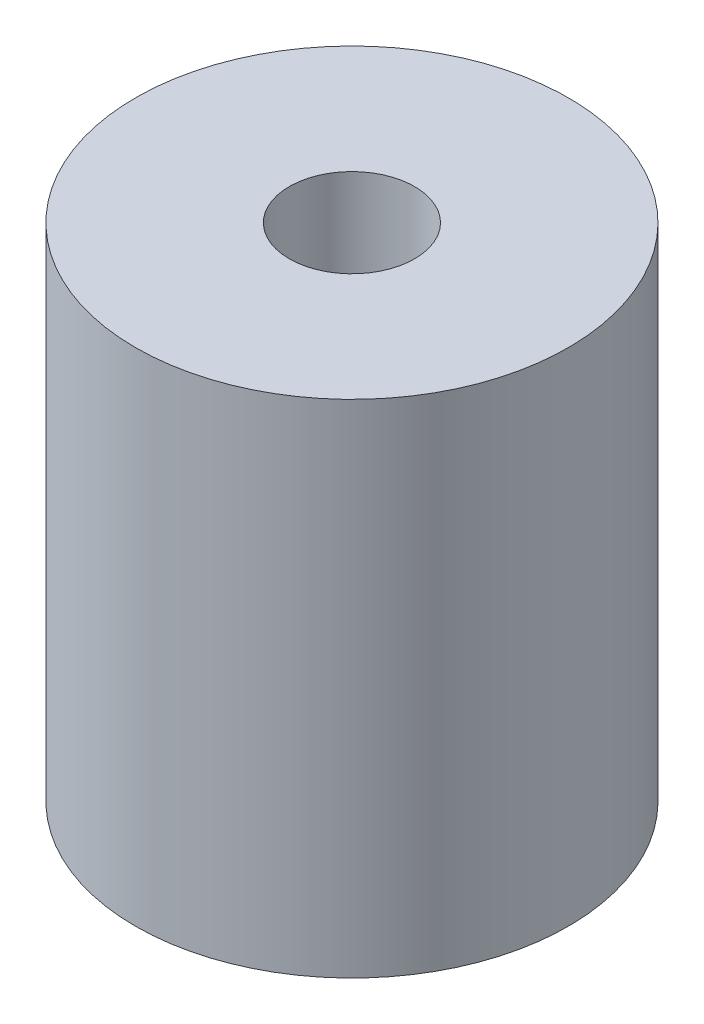
from build123d import *

# Parameters (mm, degrees)
ESBO_O1_R                = 9.5
ESBO_O1_R_2              = 3.25
ESBO_O1_R_3              = 2.75
RESSALTO_EXTRUS_O1_DEPTH = 11


with BuildPart() as part:
    # Esboço1 → Ressalto-extrusão1 (new, symmetric)
    # profile 1 of 2: a face of its own
    with BuildSketch(Plane(origin=(0, 0, 0), x_dir=(1, 0, 0), z_dir=(0, 1, 0))):
        with Locations(Location((0, 0, 0), (0, 0, 270))):
            Circle(ESBO_O1_R)
        Circle(ESBO_O1_R_2, mode=Mode.SUBTRACT)
    # profile 2 of 2: a face of its own
    with BuildSketch(Plane(origin=(0, 0, 0), x_dir=(1, 0, 0), z_dir=(0, 1, 0))):
        Circle(ESBO_O1_R_2)
        with Locations(Location((0, 0, 0), (0, 0, 270))):
            Circle(ESBO_O1_R_3, mode=Mode.SUBTRACT)
    extrude(amount=RESSALTO_EXTRUS_O1_DEPTH, both=True)


solid = part.part
